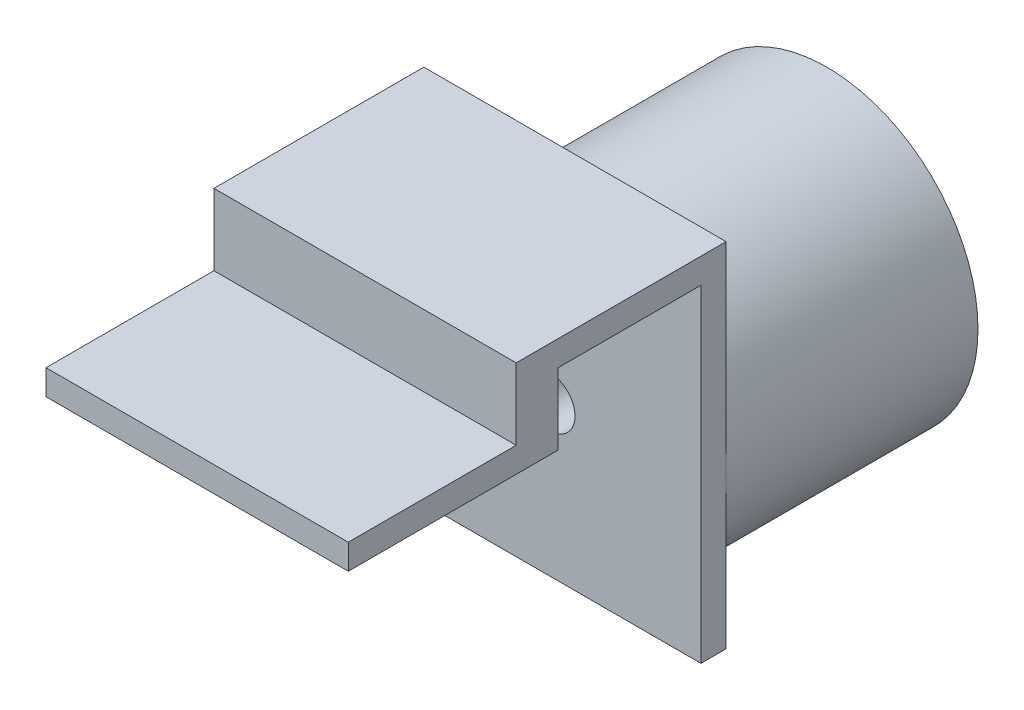
from build123d import *

# Parameters (mm, degrees)
SKETCH2_R               = 18
BOSS_EXTRUDE1_DEPTH     = 30
SKETCH4_W               = 36
SKETCH4_H               = 42
BOSS_EXTRUDE2_DEPTH     = 3
CUT_EXTRUDE1_DEPTH      = 3
CUT_EXTRUDE1_DEPTH_BACK = 60
SKETCH3_R               = 3
SKETCH6_W               = 36
SKETCH6_H               = 17
BOSS_EXTRUDE3_DEPTH     = 3
BOSS_EXTRUDE4_DEPTH     = 5
SKETCH8_W               = 36
SKETCH8_H               = 3
BOSS_EXTRUDE5_DEPTH     = 20


with BuildPart() as part:
    # Sketch2 → Boss-Extrude1 (new body)
    with BuildSketch(Plane.XY):
        Circle(SKETCH2_R)
    extrude(amount=BOSS_EXTRUDE1_DEPTH)

    # Sketch4 → Boss-Extrude2 (add)
    with BuildSketch(Plane.XY.offset(30)):
        with Locations((0, 3)):
            Rectangle(SKETCH4_W, SKETCH4_H)
    extrude(amount=BOSS_EXTRUDE2_DEPTH)

    # Sketch3 → Cut-Extrude1 (cut, two sides: drawn at the far end of the back side and taken through both)
    with BuildSketch(Plane.XY.offset(30).offset(-CUT_EXTRUDE1_DEPTH_BACK)):
        Circle(SKETCH3_R)
    extrude(amount=CUT_EXTRUDE1_DEPTH + CUT_EXTRUDE1_DEPTH_BACK, mode=Mode.SUBTRACT)

    # Sketch6 → Boss-Extrude3 (add)
    with BuildSketch(Plane(origin=(0, 24, 0), x_dir=(1, 0, 0), z_dir=(0, 1, 0))):
        with Locations((0, -41.5)):
            Rectangle(SKETCH6_W, SKETCH6_H)
    extrude(amount=-BOSS_EXTRUDE3_DEPTH)

    # Sketch7 → Boss-Extrude4 (add)
    with BuildSketch(Plane.XY.offset(50)):
        Polygon((18, 21), (18, 12.5), (-18, 12.5), (-18, 21), (-18, 24), (18, 24), align=None)
    extrude(amount=BOSS_EXTRUDE4_DEPTH)

    # Sketch8 → Boss-Extrude5 (add)
    with BuildSketch(Plane.XY.offset(55)):
        with Locations((0, 14)):
            Rectangle(SKETCH8_W, SKETCH8_H)
    extrude(amount=BOSS_EXTRUDE5_DEPTH)


solid = part.part
